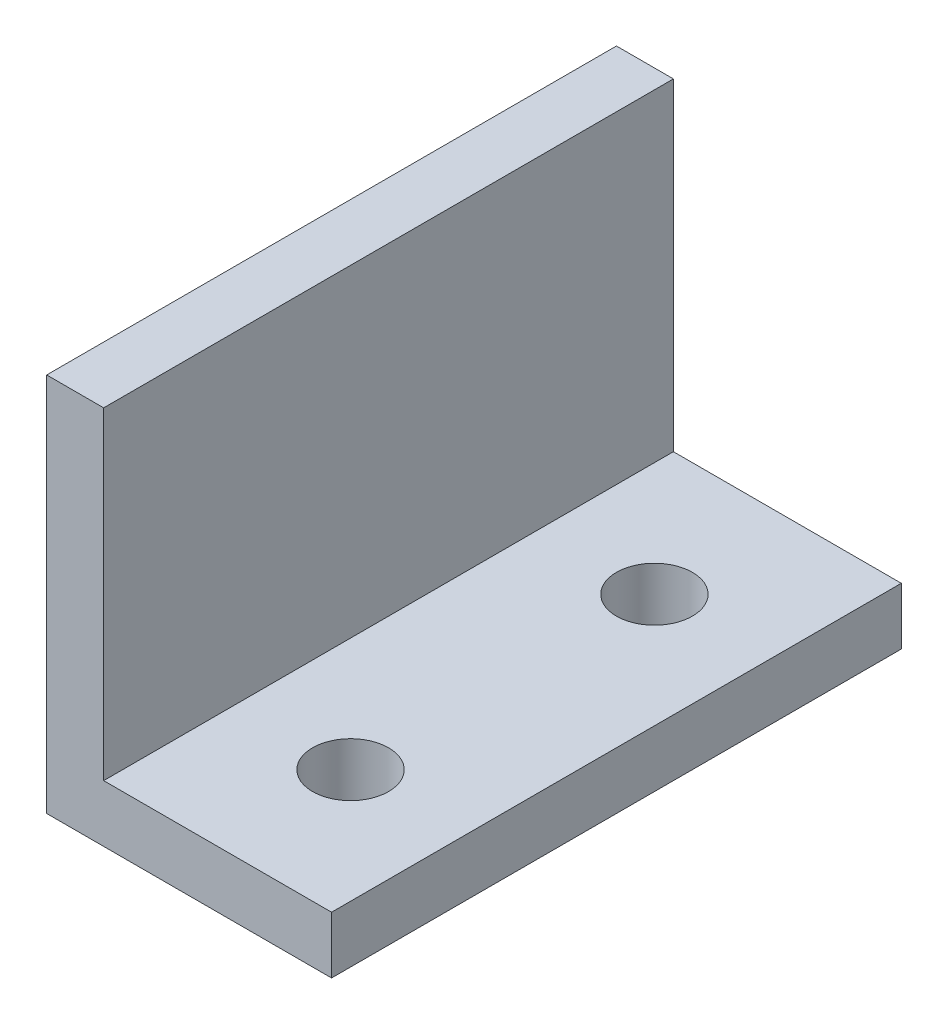
from build123d import *

# Parameters (mm, degrees)
BOSS_EXTRUDE1_DEPTH = 30
SKETCH2_R           = 2
CUT_EXTRUDE1_DEPTH  = 3


with BuildPart() as part:
    # Sketch1 → Boss-Extrude1 (new body)
    with BuildSketch(Plane.XY):
        Polygon((0, 0), (0, 20), (3, 20), (3, 3), (15, 3), (15, 0), align=None)
    extrude(amount=BOSS_EXTRUDE1_DEPTH)

    # Sketch2 → Cut-Extrude1 (cut)
    with BuildSketch(Plane(origin=(0, 3, 0), x_dir=(1, 0, 0), z_dir=(0, 1, 0))):
        with Locations(Location((9, -7, 0), (0, 0, 180))):
            Circle(SKETCH2_R)
        with Locations((9, -23)):
            Circle(SKETCH2_R)
    extrude(amount=-CUT_EXTRUDE1_DEPTH, mode=Mode.SUBTRACT)


solid = part.part
